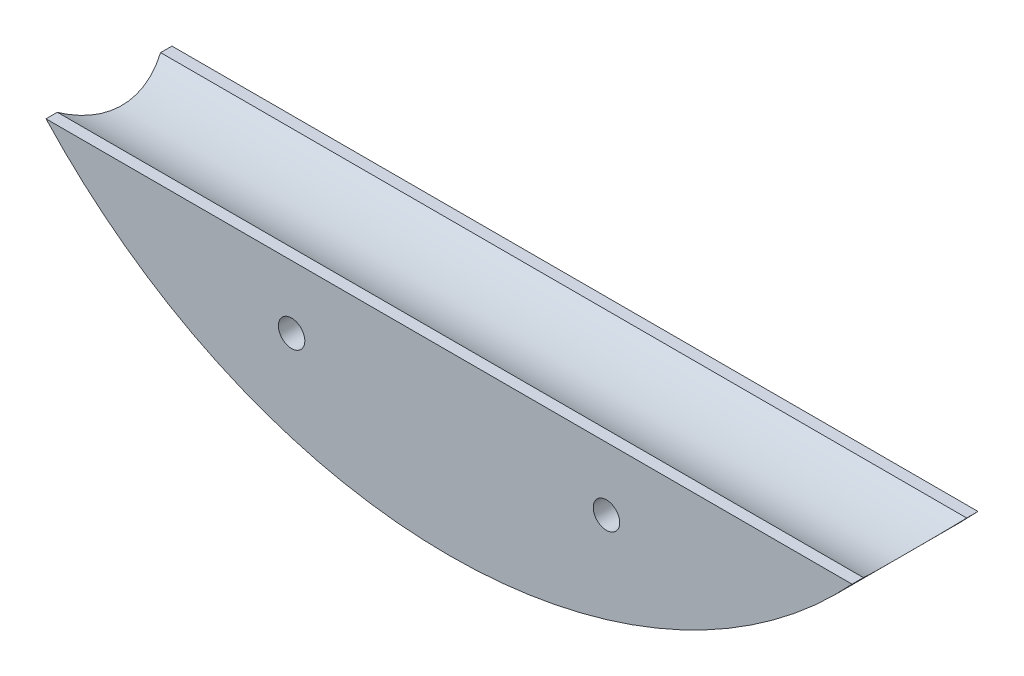
from build123d import *

# Parameters (mm, degrees)
EXTRUDE_1_DEPTH     = 20
SKETCH_2_R          = 16.745148551
CUT_EXTRUDE_1_DEPTH = 133.554049902
M5X0_82_D           = 4.2
M5X0_82_DEPTH       = 9.5
M5X0_82_TIP         = 1.2618073
M5X0_81_D           = 4.2
M5X0_81_DEPTH       = 9.5
M5X0_81_TIP         = 1.2618073


with BuildPart() as part:
    # Эскиз1 → Бобышка-Вытянуть1 (new body)
    with BuildSketch(Plane.XY):
        with BuildLine():
            Line((0, 0), (128, 0))
            ThreePointArc((128, 0), (64, -28.045964869), (0, 0))
        make_face()
    extrude(amount=EXTRUDE_1_DEPTH)

    # Эскиз2 → Вырез-Вытянуть1 (cut, through all)
    with BuildSketch(Plane(origin=(0, 0, 0), x_dir=(0, 0, -1), z_dir=(1, 0, 0))):
        with Locations((-10, 14.6)):
            Circle(SKETCH_2_R)
    extrude(amount=CUT_EXTRUDE_1_DEPTH, mode=Mode.SUBTRACT)

    # Отверстие обработанное метчиком M5x0.82
    with Locations(Plane.XY.offset(20)):
        with Locations((39, -10)):
            Hole(M5X0_82_D / 2, depth=M5X0_82_DEPTH)
            with Locations((0, 0, -(M5X0_82_DEPTH + M5X0_82_TIP / 2))):  # 118° drill point
                Cone(0, M5X0_82_D / 2, M5X0_82_TIP, mode=Mode.SUBTRACT)

    # Отверстие обработанное метчиком M5x0.81
    with Locations(Plane.XY.offset(20)):
        with Locations((89, -10)):
            Hole(M5X0_81_D / 2, depth=M5X0_81_DEPTH)
            with Locations((0, 0, -(M5X0_81_DEPTH + M5X0_81_TIP / 2))):  # 118° drill point
                Cone(0, M5X0_81_D / 2, M5X0_81_TIP, mode=Mode.SUBTRACT)


solid = part.part
